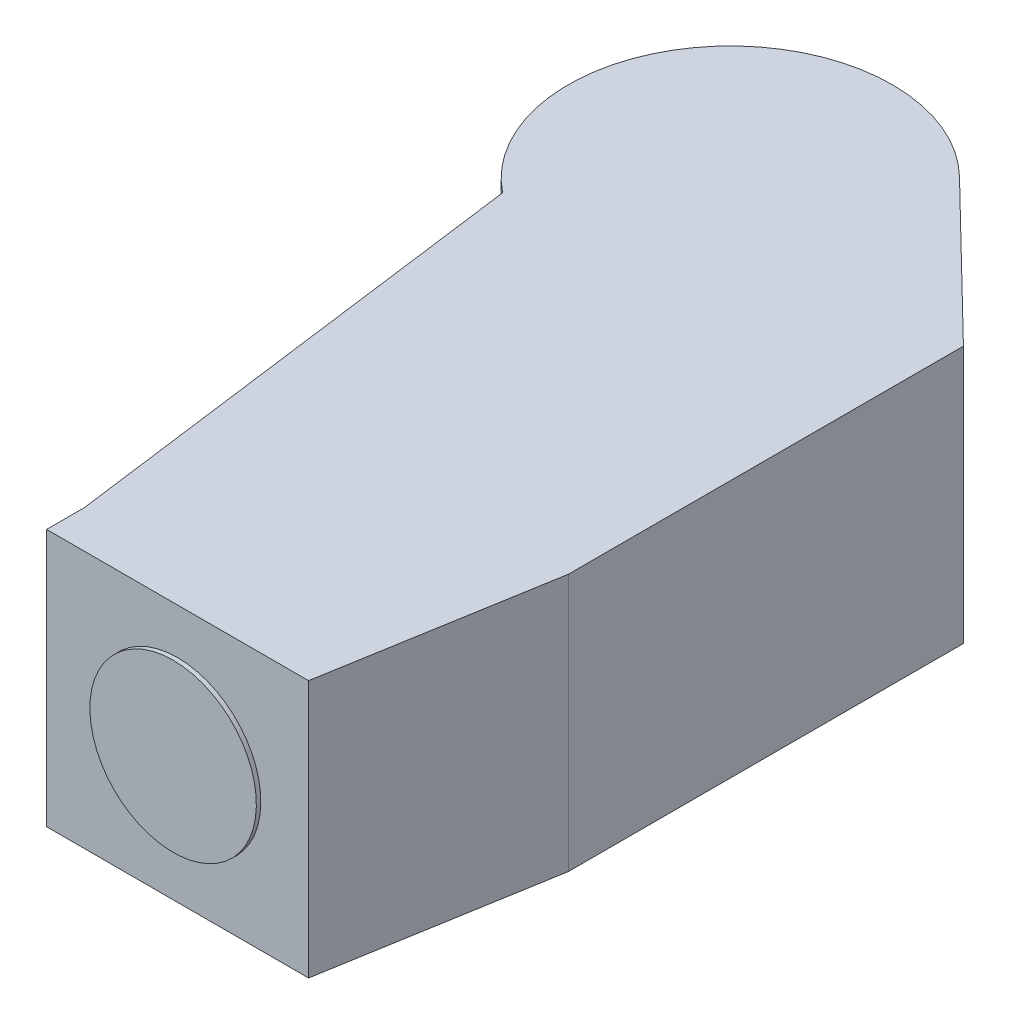
from build123d import *

# Parameters (mm, degrees)
BOSS_EXTRUDE1_DEPTH   = 58
SKETCH2_R             = 37.5
BOSS_EXTRUDE2_DEPTH   = 2
BODY_MOVE_COPY2_ANGLE = 120


with BuildPart() as part:
    # Sketch1 → Boss-Extrude1 (new, symmetric)
    with BuildSketch(Plane.XY):
        with BuildLine():
            Line((291, 0), (291, 17))
            Line((291, 17), (274, 17))
            Line((274, 17), (57, 45.607017004))
            ThreePointArc((57, 45.607017004), (-48.32227677, 54.71706834), (-52.304922539, -50.92342367))
            Line((-52.304922539, -50.92342367), (13, -118))
            Line((13, -118), (191, -118))
            Line((191, -118), (291, -101))
            Line((291, -101), (291, 0))
        make_face()
    extrude(amount=BOSS_EXTRUDE1_DEPTH, both=True)

    # Sketch2 → Boss-Extrude2 (add)
    with BuildSketch(Plane(origin=(291, 0, 0), x_dir=(0, 0, -1), z_dir=(1, 0, 0))):
        with Locations((0, -42)):
            Circle(SKETCH2_R)
    extrude(amount=BOSS_EXTRUDE2_DEPTH)


with BuildPart() as part_1:
    # Body-Move/Copy1: moved
    add(part.part.moved(Location((-293, 42, 0))))


with BuildPart() as part_2:
    # Body-Move/Copy2: moved
    add(part_1.part.rotate(Axis((0, 0, 0), (0.5773502691896272, -0.5773502691896252, 0.5773502691896252)), BODY_MOVE_COPY2_ANGLE))


solid = part_2.part
